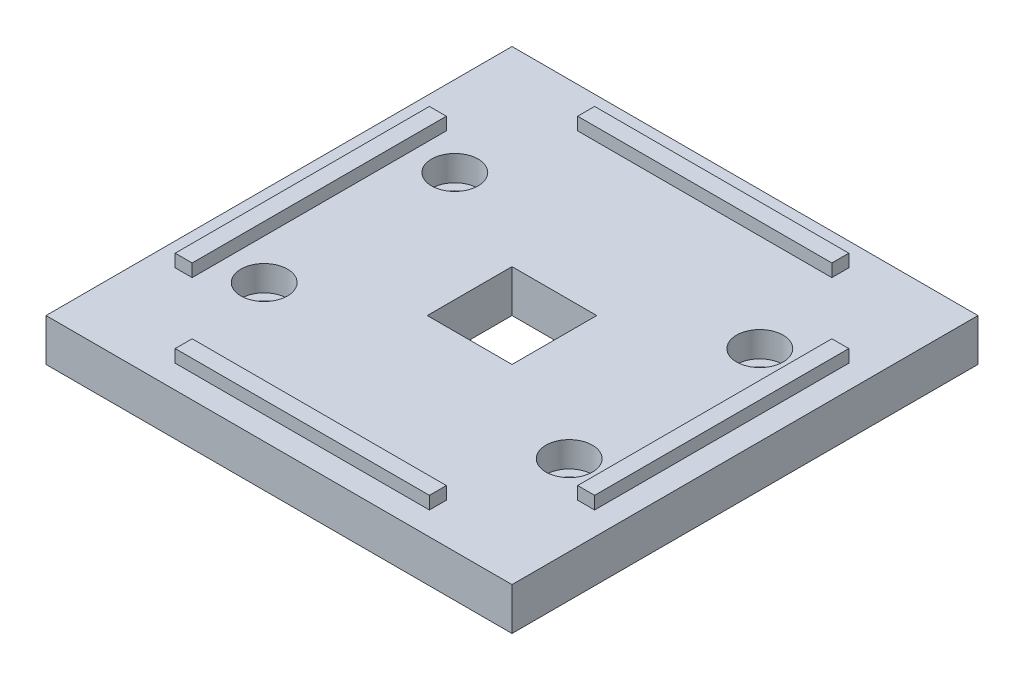
from build123d import *

# Parameters (mm, degrees)
CROQUIS1_W              = 55
CROQUIS1_H              = 55
SALIENTE_EXTRUIR1_DEPTH = 5
CROQUIS2_W              = 30
CROQUIS2_H              = 2
CROQUIS2_W_2            = 2
CROQUIS2_H_2            = 30
SALIENTE_EXTRUIR2_DEPTH = 1.5
CROQUIS3_R              = 1.6
CORTAR_EXTRUIR1_DEPTH   = 5
CROQUIS6_W              = 10
CROQUIS6_H              = 10
CORTAR_EXTRUIR4_DEPTH   = 10
CROQUIS7_R              = 2.75
CORTAR_EXTRUIR5_DEPTH   = 3


with BuildPart() as part:
    # Croquis1 → Saliente-Extruir1 (new body)
    with BuildSketch(Plane(origin=(0, 0, 0), x_dir=(1, 0, 0), z_dir=(0, 1, 0))):
        with Locations((27.5, 27.5)):
            Rectangle(CROQUIS1_W, CROQUIS1_H)
    extrude(amount=SALIENTE_EXTRUIR1_DEPTH)

    # Croquis2 → Saliente-Extruir2 (add)
    with BuildSketch(Plane(origin=(0, 5, 0), x_dir=(1, 0, 0), z_dir=(0, 1, 0))):
        with Locations((27.5, 51.25)):
            Rectangle(CROQUIS2_W, CROQUIS2_H)
        with Locations((3.75, 27.5)):
            Rectangle(CROQUIS2_W_2, CROQUIS2_H_2)
        with Locations((51.25, 27.5)):
            Rectangle(CROQUIS2_W_2, CROQUIS2_H_2)
        with Locations((27.5, 3.75)):
            Rectangle(CROQUIS2_W, CROQUIS2_H)
    extrude(amount=SALIENTE_EXTRUIR2_DEPTH)

    # Croquis3 → Cortar-Extruir1 (cut)
    with BuildSketch(Plane(origin=(0, 5, 0), x_dir=(1, 0, 0), z_dir=(0, 1, 0))):
        with Locations(Location((9.5, 38.75, 0), (0, 0, 270))):
            Circle(CROQUIS3_R)
        with Locations(Location((9.5, 16.25, 0), (0, 0, 270))):
            Circle(CROQUIS3_R)
        with Locations(Location((45.5, 38.75, 0), (0, 0, 90))):
            Circle(CROQUIS3_R)
        with Locations(Location((45.5, 16.25, 0), (0, 0, 90))):
            Circle(CROQUIS3_R)
    extrude(amount=-CORTAR_EXTRUIR1_DEPTH, mode=Mode.SUBTRACT)

    # Croquis6 → Cortar-Extruir4 (cut)
    with BuildSketch(Plane(origin=(0, 5, 0), x_dir=(1, 0, 0), z_dir=(0, 1, 0))):
        with Locations((27.5, 27.5)):
            Rectangle(CROQUIS6_W, CROQUIS6_H)
    extrude(amount=-CORTAR_EXTRUIR4_DEPTH, mode=Mode.SUBTRACT)

    # Croquis7 → Cortar-Extruir5 (cut)
    with BuildSketch(Plane(origin=(0, 5, 0), x_dir=(1, 0, 0), z_dir=(0, 1, 0))):
        with Locations(Location((9.5, 38.75, 0), (0, 0, 270))):
            Circle(CROQUIS7_R)
        with Locations(Location((45.5, 38.75, 0), (0, 0, 270))):
            Circle(CROQUIS7_R)
        with Locations(Location((45.5, 16.25, 0), (0, 0, 270))):
            Circle(CROQUIS7_R)
        with Locations(Location((9.5, 16.25, 0), (0, 0, 270))):
            Circle(CROQUIS7_R)
    extrude(amount=-CORTAR_EXTRUIR5_DEPTH, mode=Mode.SUBTRACT)


solid = part.part
